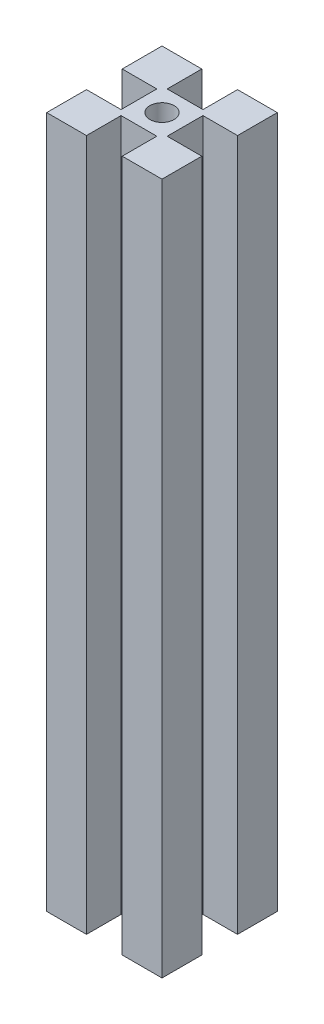
from build123d import *

# Parameters (mm, degrees)
SK_P01_P2020_R  = 2.1
P01_P2020_DEPTH = 120


with BuildPart() as part:
    # SK_P01_p2020 → P01_p2020 (new body)
    with BuildSketch(Plane(origin=(0, 0, 0), x_dir=(1, 0, 0), z_dir=(0, 1, 0))):
        Polygon((10, -10), (10, -3.1), (4, -3.1), (4, 3.1), (10, 3.1), (10, 10), (3.1, 10), (3.1, 4), (-3.1, 4), (-3.1, 10), (-10, 10), (-10, 3.1), (-4, 3.1), (-4, -3.1), (-10, -3.1), (-10, -10), (-3.1, -10), (-3.1, -4), (3.1, -4), (3.1, -10), align=None)
        with Locations(Location((0, 0, 0), (0, 0, 270))):
            Circle(SK_P01_P2020_R, mode=Mode.SUBTRACT)
    extrude(amount=P01_P2020_DEPTH)


solid = part.part
